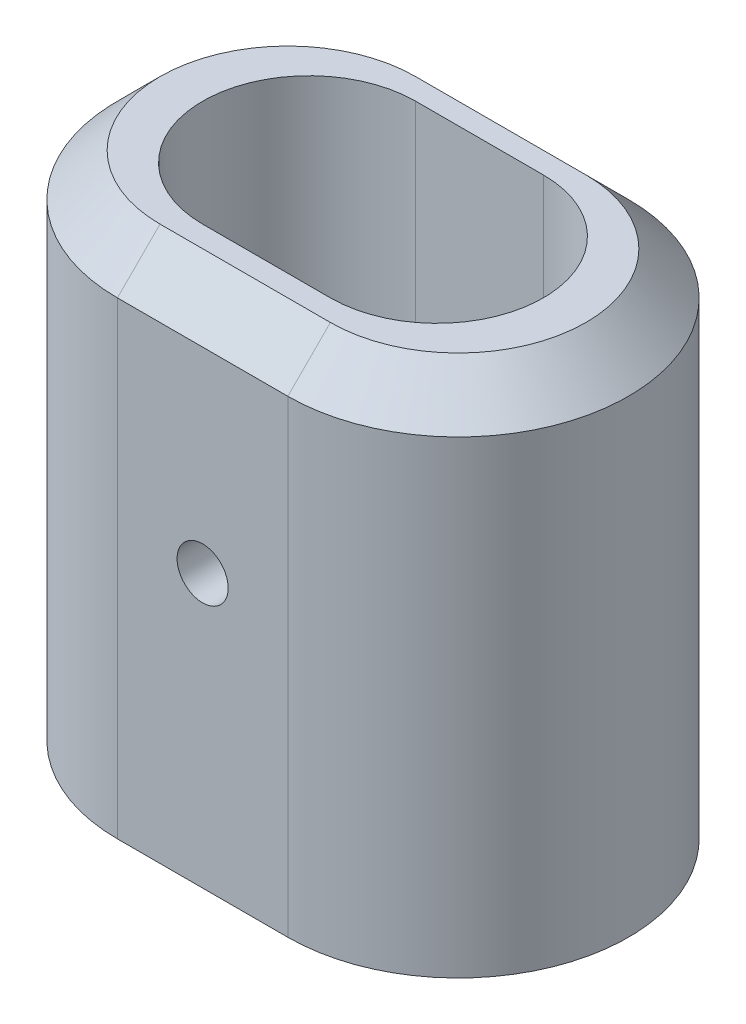
from build123d import *

# Parameters (mm, degrees)
EXTRUDE_1_DEPTH = 60
CHAMFER_1_SIZE  = 5
SKETCH_2_R      = 3
EXTRUDE_2_DEPTH = 60


with BuildPart() as part:
    # 草圖1 → 擠出1 (new body)
    with BuildSketch(Plane(origin=(0, 0, 0), x_dir=(-1, 0, 0), z_dir=(0, 1, 0))):
        with BuildLine():
            Line((10, -20), (-10, -20))
            ThreePointArc((-10, -20), (-30, 0), (-10, 20))
            Line((-10, 20), (10, 20))
            ThreePointArc((10, 20), (30, 0), (10, -20))
        make_face()
        with BuildLine():
            ThreePointArc((7.5, -12.5), (20, 0), (7.5, 12.5))
            Line((7.5, 12.5), (-7.5, 12.5))
            ThreePointArc((-7.5, 12.5), (-20, 0), (-7.5, -12.5))
            Line((-7.5, -12.5), (7.5, -12.5))
        make_face(mode=Mode.SUBTRACT)
    extrude(amount=EXTRUDE_1_DEPTH)

    # 倒角1
    chamfer_1_edges = [part.edges().sort_by_distance(p)[0] for p in [
        (0, 60, -20),
        (-30, 60, 0),
        (0, 60, 20),
        (30, 60, 0),
    ]]
    chamfer(chamfer_1_edges, length=CHAMFER_1_SIZE)

    # 草圖2 → 擠出2 (cut)
    with BuildSketch(Plane.XY.offset(20)):
        with Locations((0, 32)):
            Circle(SKETCH_2_R)
    extrude(amount=-EXTRUDE_2_DEPTH, mode=Mode.SUBTRACT)


solid = part.part
